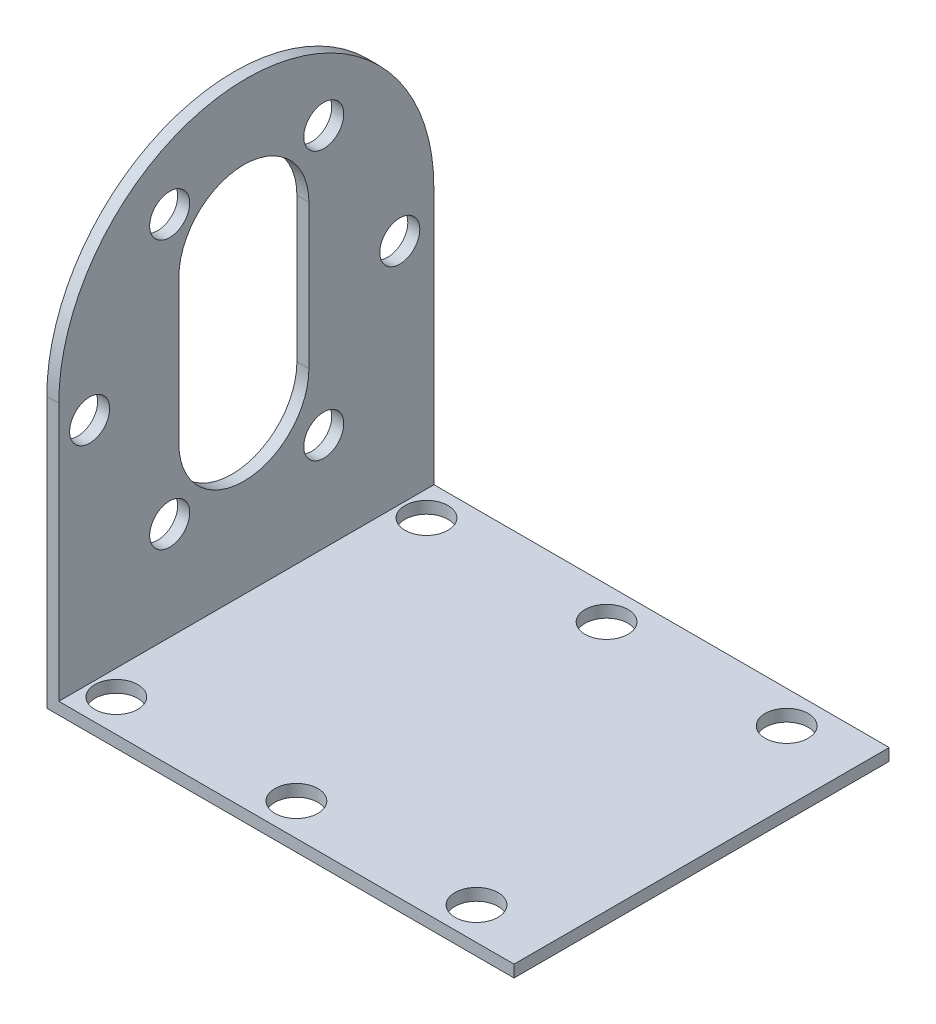
from build123d import *

# Parameters (mm, degrees)
ESQUISSE1_W             = 45.5
ESQUISSE1_H             = 37.5
ESQUISSE1_R             = 2.15
BOSS_EXTRU_1_DEPTH      = 1.2
BOSS_EXTRU_2_DEPTH      = 1.2
ENL_V_MAT_EXTRU_2_DEPTH = 75.623947588
ESQUISSE9_R             = 2
ENL_V_MAT_EXTRU_3_DEPTH = 75.623947588


with BuildPart() as part:
    # Esquisse1 → Boss.-Extru.1 (new body)
    with BuildSketch(Plane(origin=(0, 0, 0), x_dir=(1, 0, 0), z_dir=(0, 1, 0))):
        with Locations((22.75, 18.75)):
            Rectangle(ESQUISSE1_W, ESQUISSE1_H)
        with Locations(Location((2.5, 34.25, 0), (0, 0, 270))):
            Circle(ESQUISSE1_R, mode=Mode.SUBTRACT)
        with Locations(Location((20.5, 34.25, 0), (0, 0, 270))):
            Circle(ESQUISSE1_R, mode=Mode.SUBTRACT)
        with Locations(Location((38.5, 34.25, 0), (0, 0, 270))):
            Circle(ESQUISSE1_R, mode=Mode.SUBTRACT)
        with Locations(Location((2.5, 3.25, 0), (0, 0, 270))):
            Circle(ESQUISSE1_R, mode=Mode.SUBTRACT)
        with Locations(Location((20.5, 3.25, 0), (0, 0, 270))):
            Circle(ESQUISSE1_R, mode=Mode.SUBTRACT)
        with Locations(Location((38.5, 3.25, 0), (0, 0, 270))):
            Circle(ESQUISSE1_R, mode=Mode.SUBTRACT)
    extrude(amount=BOSS_EXTRU_1_DEPTH)

    # Esquisse4 → Boss.-Extru.2 (add)
    with BuildSketch(Plane.ZY):
        with BuildLine():
            Line((-37.48187916, 0), (-37.48187916, 27))
            ThreePointArc((-37.48187916, 27), (-18.74093958, 45.74093958), (0, 27))
            Line((0, 27), (0, 0))
            Line((0, 0), (-37.48187916, 0))
        make_face()
    extrude(amount=BOSS_EXTRU_2_DEPTH)

    # Esquisse5 → Enlèv. mat.-Extru.2 (cut, through all)
    with BuildSketch(Plane(origin=(0, 0, 0), x_dir=(0, 0, -1), z_dir=(1, 0, 0))):
        with BuildLine():
            Line((25, 31.9), (25, 17.5))
            ThreePointArc((25, 17.5), (18.5, 11), (12, 17.5))
            Line((12, 17.5), (12, 31.9))
            ThreePointArc((12, 31.9), (18.5, 38.4), (25, 31.9))
        make_face()
    extrude(amount=-ENL_V_MAT_EXTRU_2_DEPTH, mode=Mode.SUBTRACT)

    # Esquisse9 → Enlèv. mat.-Extru.3 (cut, through all)
    with BuildSketch(Plane(origin=(0, 0, 0), x_dir=(0, 0, -1), z_dir=(1, 0, 0))):
        with Locations((26.48187916, 11)):
            Circle(ESQUISSE9_R)
        with Locations((26.48187916, 37.8)):
            Circle(ESQUISSE9_R)
        with Locations((11.08187916, 11)):
            Circle(ESQUISSE9_R)
        with Locations((11.08187916, 37.8)):
            Circle(ESQUISSE9_R)
        with Locations((34.08187916, 24)):
            Circle(ESQUISSE9_R)
        with Locations((3.08187916, 24)):
            Circle(ESQUISSE9_R)
    extrude(amount=-ENL_V_MAT_EXTRU_3_DEPTH, mode=Mode.SUBTRACT)


solid = part.part
